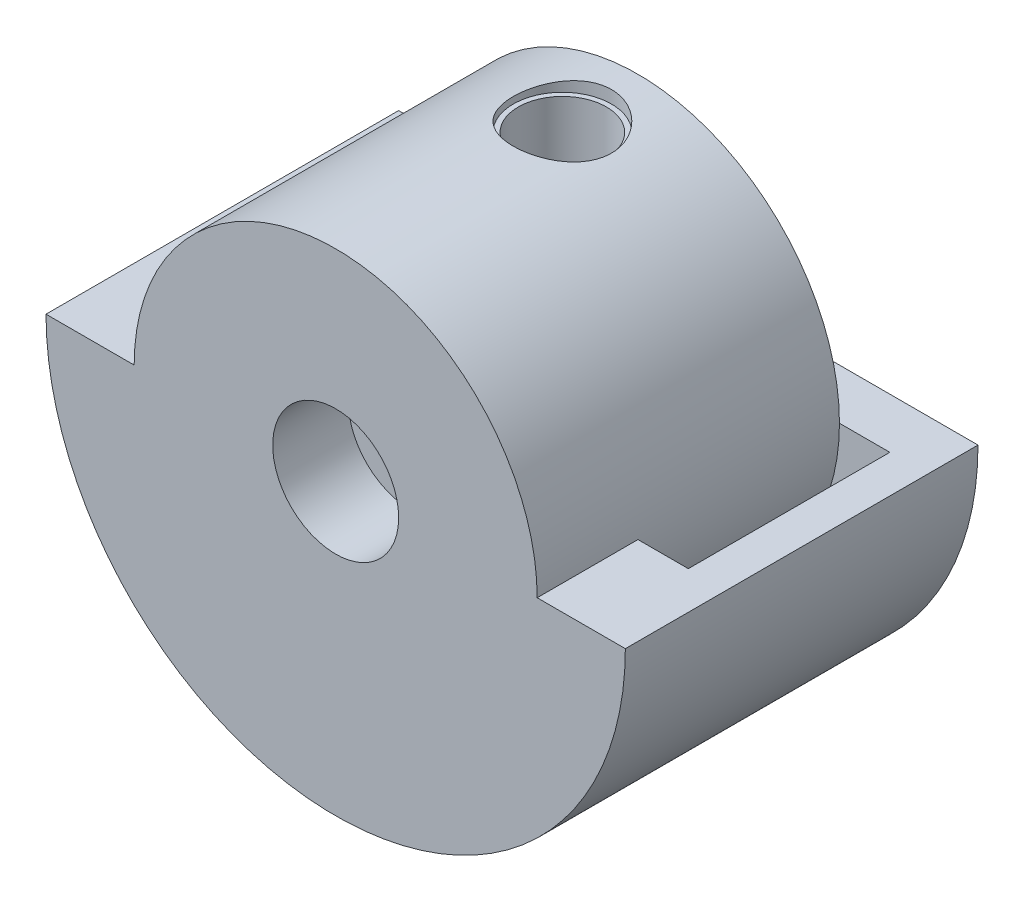
from build123d import *

# Parameters (mm, degrees)
SKETCH_1_R           = 5
SKETCH_1_R_2         = 2.5
EXTRUDE_1_DEPTH      = 6
SKETCH_2_R           = 2.5
EXTRUDE_2_DEPTH      = 3
SKETCH_3_R           = 1.25
CUT_EXTRUDE_3_DEPTH  = 10.273618495
EXTRUDE_START        = -12
SKETCH_8_R           = 8
SKETCH_8_R_2         = 5
EXTRUDE_4_DEPTH      = 12
SKETCH_11_R          = 1.75
CUT_EXTRUDE_4_DEPTH  = 12
SKETCH_12_R          = 1.95
CUT_EXTRUDE_5_DEPTH  = 0.5
EXTRUDE_START_2      = -10
EXTRUDE_5_DEPTH      = 10
FILLET_1_R           = 1
CUT_EXTRUDE_7_DEPTH  = 6
CUT_EXTRUDE_8_DEPTH  = 10
FILLET_2_R           = 10
EXTRUDE_START_3      = 2
EXTRUDE_6_DEPTH      = 2
EXTRUDE_7_DEPTH      = 2
CUT_EXTRUDE_9_DEPTH  = 27.588216719
EXTRUDE_START_4      = 6
SKETCH_20_R          = 5
SKETCH_20_R_2        = 3.5
EXTRUDE_8_DEPTH      = 6
SKETCH_21_R          = 1.75
CUT_EXTRUDE_10_DEPTH = 10


with BuildPart() as part:
    # 草图1 → 凸台-拉伸1 (new body)
    with BuildSketch(Plane.XY):
        Circle(SKETCH_1_R)
        Circle(SKETCH_1_R_2, mode=Mode.SUBTRACT)
    extrude(amount=EXTRUDE_1_DEPTH)

    # 草图2 → 凸台-拉伸2 (add)
    with BuildSketch(Plane.XY):
        Circle(SKETCH_2_R)
    extrude(amount=EXTRUDE_2_DEPTH)

    # 草图3 → 切除-拉伸3 (cut, through all)
    with BuildSketch(Plane.XY):
        Circle(SKETCH_3_R)
    extrude(amount=CUT_EXTRUDE_3_DEPTH, mode=Mode.SUBTRACT)

    # 草图8 → 凸台-拉伸4 (add)
    with BuildSketch(Plane.XY.offset(6).offset(EXTRUDE_START)):
        Circle(SKETCH_8_R)
        Circle(SKETCH_8_R_2, mode=Mode.SUBTRACT)
    extrude(amount=EXTRUDE_4_DEPTH)

    # 草图11 → 切除-拉伸4 (cut)
    with BuildSketch(Plane(origin=(0, 8, 0), x_dir=(1, 0, 0), z_dir=(0, 1, 0))):
        with Locations(Location((0, 3, 0), (0, 0, 270))):
            Circle(SKETCH_11_R)
    extrude(amount=-CUT_EXTRUDE_4_DEPTH, mode=Mode.SUBTRACT)

    # 草图12 → 切除-拉伸5 (cut)
    with BuildSketch(Plane(origin=(0, 8, 0), x_dir=(1, 0, 0), z_dir=(0, 1, 0))):
        with Locations(Location((0, 3, 0), (0, 0, 270))):
            Circle(SKETCH_12_R)
    extrude(amount=-CUT_EXTRUDE_5_DEPTH, mode=Mode.SUBTRACT)

    # 草图13 → 凸台-拉伸5 (add)
    with BuildSketch(Plane.XY.offset(6).offset(EXTRUDE_START_2)):
        with BuildLine():
            Line((-8, 0), (-16, 0))
            ThreePointArc((-16, 0), (0, -16), (16, 0))
            Line((16, 0), (8, 0))
            ThreePointArc((8, 0), (0, -8), (-8, 0))
        make_face()
    extrude(amount=EXTRUDE_5_DEPTH)

    # 圆角1
    fillet_1_edges = [part.edges().sort_by_distance(p)[0] for p in [
        (16, 0, 1),
        (-16, 0, 1),
    ]]
    fillet(fillet_1_edges, radius=FILLET_1_R)

    # 草图15 → 切除-拉伸7 (cut)
    with BuildSketch(Plane(origin=(0, 0, -4), x_dir=(-1, 0, 0), z_dir=(0, 0, -1))):
        with BuildLine():
            Line((-10, 0), (-8, 0))
            ThreePointArc((-8, 0), (0, -8), (8, 0))
            Line((8, 0), (10, 0))
            ThreePointArc((10, 0), (0, -10), (-10, 0))
        make_face()
    extrude(amount=-CUT_EXTRUDE_7_DEPTH, mode=Mode.SUBTRACT)

    # 草图16 → 切除-拉伸8 (cut)
    with BuildSketch(Plane(origin=(0, 0, -4), x_dir=(-1, 0, 0), z_dir=(0, 0, -1))):
        with BuildLine():
            Line((11.661330827, 0), (14.966629547, 0))
            ThreePointArc((14.966629547, 0), (15.69692629, -0.316869949), (15.96440485, -1.066666667))
            ThreePointArc((15.96440485, -1.066666667), (13.334766709, -8.842171499), (7.195716327, -14.290614631))
            ThreePointArc((7.195716327, -14.290614631), (10.518928308, -7.486043338), (11.661330827, 0))
        make_face()
    extrude(amount=-CUT_EXTRUDE_8_DEPTH, mode=Mode.SUBTRACT)

    # 圆角2
    fillet_2_edges = [part.edges().sort_by_distance(p)[0] for p in [
        (-7.195716327, -14.290614631, 1),
    ]]
    fillet(fillet_2_edges, radius=FILLET_2_R)

    # 草图17 → 凸台-拉伸6 (add)
    with BuildSketch(Plane(origin=(0, 0, -4), x_dir=(-1, 0, 0), z_dir=(0, 0, -1)).offset(EXTRUDE_START_3)):
        with BuildLine():
            Line((10, 0), (11.661330827, 0))
            ThreePointArc((11.661330827, 0), (11.141957729, -5.079523953), (9.605333334, -9.948825493))
            ThreePointArc((9.605333334, -9.948825493), (6.210515001, -14.141064577), (1.131984253, -15.95990638))
            ThreePointArc((1.131984253, -15.95990638), (-10.509629988, -12.064314217), (-15.96440485, -1.066666667))
            ThreePointArc((-15.96440485, -1.066666667), (-15.69692629, -0.316869949), (-14.966629547, 0))
            Line((-14.966629547, 0), (-10, 0))
            ThreePointArc((-10, 0), (0, -10), (10, 0))
        make_face()
    extrude(amount=-EXTRUDE_6_DEPTH)

    # 草图18 → 凸台-拉伸7 (add)
    with BuildSketch(Plane(origin=(0, 0, -6), x_dir=(-1, 0, 0), z_dir=(0, 0, -1)).offset(EXTRUDE_START_3)):
        with BuildLine():
            Line((10, 0), (11.661330827, 0))
            ThreePointArc((11.661330827, 0), (11.141957729, -5.079523953), (9.605333334, -9.948825493))
            ThreePointArc((9.605333334, -9.948825493), (6.210515001, -14.141064577), (1.131984253, -15.95990638))
            ThreePointArc((1.131984253, -15.95990638), (-10.509629988, -12.064314217), (-15.96440485, -1.066666667))
            ThreePointArc((-15.96440485, -1.066666667), (-15.69692629, -0.316869949), (-14.966629547, 0))
            Line((-14.966629547, 0), (-10, 0))
            Line((-10, 0), (-8, 0))
            Line((-8, 0), (-5, 0))
            ThreePointArc((-5, 0), (0, -5), (5, 0))
            Line((5, 0), (8, 0))
            Line((8, 0), (10, 0))
        make_face()
    extrude(amount=-EXTRUDE_7_DEPTH)

    # 草图19 → 切除-拉伸9 (cut, through all)
    with BuildSketch(Plane(origin=(0, 0, -8), x_dir=(-1, 0, 0), z_dir=(0, 0, -1))):
        with BuildLine():
            Line((11.661330827, 0), (11.5, 0))
            ThreePointArc((11.5, 0), (0, -11.5), (-11.5, 0))
            Line((-11.5, 0), (-14.966629547, 0))
            ThreePointArc((-14.966629547, 0), (-15.69692629, -0.316869949), (-15.96440485, -1.066666667))
            ThreePointArc((-15.96440485, -1.066666667), (-10.509629988, -12.064314217), (1.131984253, -15.95990638))
            ThreePointArc((1.131984253, -15.95990638), (6.210515001, -14.141064577), (9.605333334, -9.948825493))
            ThreePointArc((9.605333334, -9.948825493), (11.141957729, -5.079523953), (11.661330827, 0))
        make_face()
    extrude(amount=-CUT_EXTRUDE_9_DEPTH, mode=Mode.SUBTRACT)

    # 草图20 → 凸台-拉伸8 (add)
    with BuildSketch(Plane(origin=(0, 0, 0), x_dir=(-1, 0, 0), z_dir=(0, 0, -1)).offset(EXTRUDE_START_4)):
        Circle(SKETCH_20_R)
        with Locations(Location((0, 0, 0), (0, 0, 180))):
            Circle(SKETCH_20_R_2, mode=Mode.SUBTRACT)
    extrude(amount=-EXTRUDE_8_DEPTH)

    # 草图21 → 切除-拉伸10 (cut)
    with BuildSketch(Plane(origin=(0, 8, 0), x_dir=(1, 0, 0), z_dir=(0, 1, 0))):
        with Locations(Location((0, 3, 0), (0, 0, 270))):
            Circle(SKETCH_21_R)
    extrude(amount=-CUT_EXTRUDE_10_DEPTH, mode=Mode.SUBTRACT)


solid = part.part
